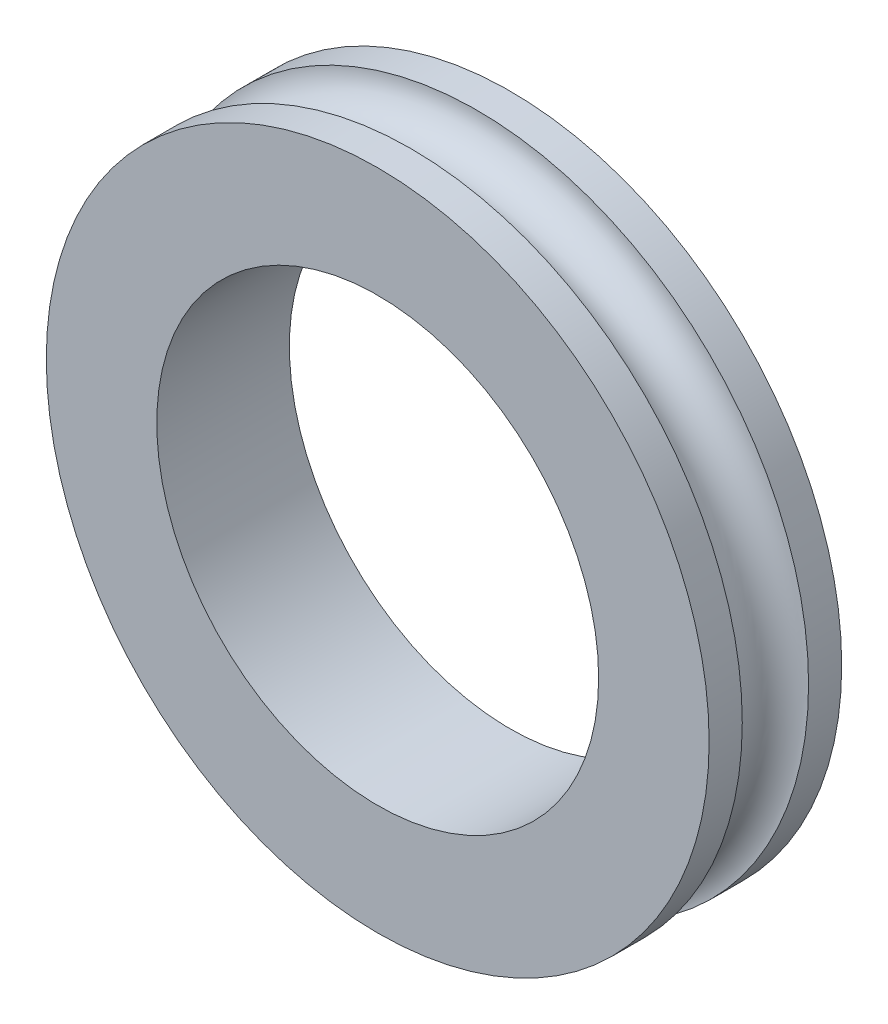
from build123d import *

# Parameters (mm, degrees)
CROQUIS1_R              = 7.5
SALIENTE_EXTRUIR1_DEPTH = 3
CROQUIS2_R              = 0.75
CROQUIS3_R              = 5
CORTAR_EXTRUIR1_DEPTH   = 12.022703843


with BuildPart() as part:
    # Croquis1 → Saliente-Extruir1 (new body)
    with BuildSketch(Plane.XY):
        Circle(CROQUIS1_R)
    extrude(amount=SALIENTE_EXTRUIR1_DEPTH)

    # Croquis2 → Cortar-Revolución1 (revolve, cut)
    with BuildSketch(Plane(origin=(0, 0, 0), x_dir=(0, 0, -1), z_dir=(1, 0, 0)), mode=Mode.PRIVATE) as cortar_revoluci_n1_sk:
        with Locations((-1.5, 7.5)):
            Circle(CROQUIS2_R)
    revolve(cortar_revoluci_n1_sk.sketch.rotate(Axis((0, 0, 3), (0, 0, -1)), 90), axis=Axis((0, 0, 3), (0, 0, -1)), mode=Mode.SUBTRACT)

    # Croquis3 → Cortar-Extruir1 (cut, through all)
    with BuildSketch(Plane.XY.offset(3)):
        Circle(CROQUIS3_R)
    extrude(amount=-CORTAR_EXTRUIR1_DEPTH, mode=Mode.SUBTRACT)


solid = part.part
